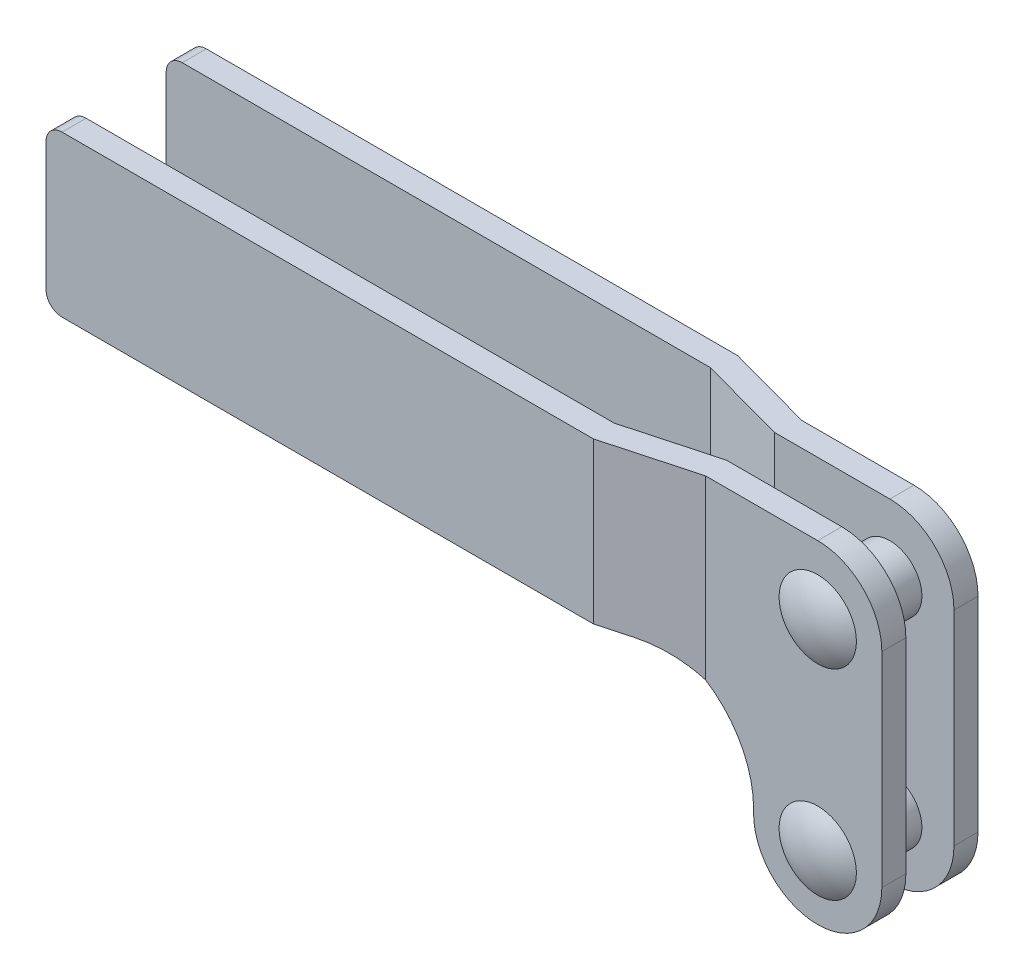
from build123d import *

# Parameters (mm, degrees)
EXTRUDE_1_DEPTH          = 41.5
EXTRUDE_2_DEPTH          = 41.5
CUT_EXTRUDE_1_DEPTH      = 9
CUT_EXTRUDE_1_DEPTH_BACK = 9
SKETCH_5_W               = 311.655321532
SKETCH_5_H               = 249.673450863


with BuildPart() as part:
    # 草图1 → 凸台-拉伸1 (new body)
    with BuildSketch(Plane(origin=(0, -8, 0), x_dir=(1, 0, 0), z_dir=(0, 1, 0))):
        Polygon((-93.3, -6), (-93.3, -9), (-25, -9), (-14, -6), (8, -6), (8, -3), (-14.401754251, -3), (-25.401754251, -6), align=None)
    extrude(amount=EXTRUDE_1_DEPTH)

    # 草图2 → 旋转1 (revolve)
    with BuildSketch(Plane(origin=(0, 0, 0), x_dir=(0, 0, -1), z_dir=(1, 0, 0))):
        with BuildLine():
            Line((-6, 4.82182538), (-6, 4))
            Line((-6, 4), (6, 4))
            Line((6, 4), (6, 4.5))
            Line((6, 4.5), (7, 4.5))
            Line((7, 4.5), (7, 0))
            Line((7, 0), (-7.5, 0))
            ThreePointArc((-7.5, 0), (-7.11634154, 2.524876235), (-6, 4.82182538))
        make_face()
    revolve(axis=Axis((0, 0, -7), (0, 0, 1)))

    # 草图3 → 旋转2 (revolve)
    with BuildSketch(Plane(origin=(0, 0, 0), x_dir=(0, 0, -1), z_dir=(1, 0, 0))):
        with BuildLine():
            Line((-6, 29.82182538), (-6, 29))
            Line((-6, 29), (6, 29))
            Line((6, 29), (6, 29.5))
            Line((6, 29.5), (7, 29.5))
            Line((7, 29.5), (7, 25))
            Line((7, 25), (-7.5, 25))
            ThreePointArc((-7.5, 25), (-7.11634154, 27.524876235), (-6, 29.82182538))
        make_face()
    revolve(axis=Axis((0, 25, -7), (0, 0, 1)))

    # 草图4 → 凸台-拉伸2 (add)
    with BuildSketch(Plane(origin=(0, -8, 0), x_dir=(1, 0, 0), z_dir=(0, 1, 0))):
        Polygon((-93.3, 6), (-25.401754251, 6), (-14.401754251, 3), (8, 3), (8, 6), (-14, 6), (-25, 9), (-93.3, 9), align=None)
    extrude(amount=EXTRUDE_2_DEPTH)

    # 草图5 → 切除-拉伸1 (cut, two sides: drawn at the far end of the back side and taken through both)
    with BuildSketch(Plane.XY.offset(-CUT_EXTRUDE_1_DEPTH_BACK)):
        with Locations((-43.959476141, 21.043348893)):
            Rectangle(SKETCH_5_W, SKETCH_5_H)
        with BuildLine():
            Line((-91.3, 13.5), (-21, 13.5))
            ThreePointArc((-21, 13.5), (-11.807611845, 9.692388155), (-8, 0.5))
            Line((-8, 0.5), (-8, 0))
            ThreePointArc((-8, 0), (0, -8), (8, 0))
            Line((8, 0), (8, 25.5))
            ThreePointArc((8, 25.5), (5.656854249, 31.156854249), (0, 33.5))
            Line((0, 33.5), (-91.3, 33.5))
            ThreePointArc((-91.3, 33.5), (-92.714213562, 32.914213562), (-93.3, 31.5))
            Line((-93.3, 31.5), (-93.3, 15.5))
            ThreePointArc((-93.3, 15.5), (-92.714213562, 14.085786438), (-91.3, 13.5))
        make_face(mode=Mode.SUBTRACT)
    extrude(amount=CUT_EXTRUDE_1_DEPTH + CUT_EXTRUDE_1_DEPTH_BACK, mode=Mode.SUBTRACT)


solid = part.part
